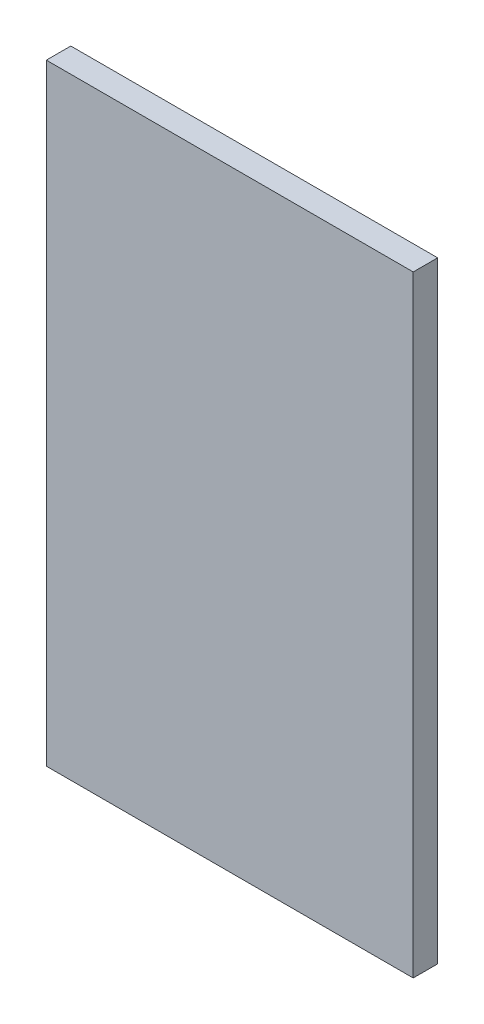
from build123d import *

# Parameters (mm, degrees)
SKETCH1_W           = 45
SKETCH1_H           = 75
BOSS_EXTRUDE1_DEPTH = 3


with BuildPart() as part:
    # Sketch1 → Boss-Extrude1 (new body)
    with BuildSketch(Plane.XY):
        Rectangle(SKETCH1_W, SKETCH1_H)
    extrude(amount=BOSS_EXTRUDE1_DEPTH)


solid = part.part
